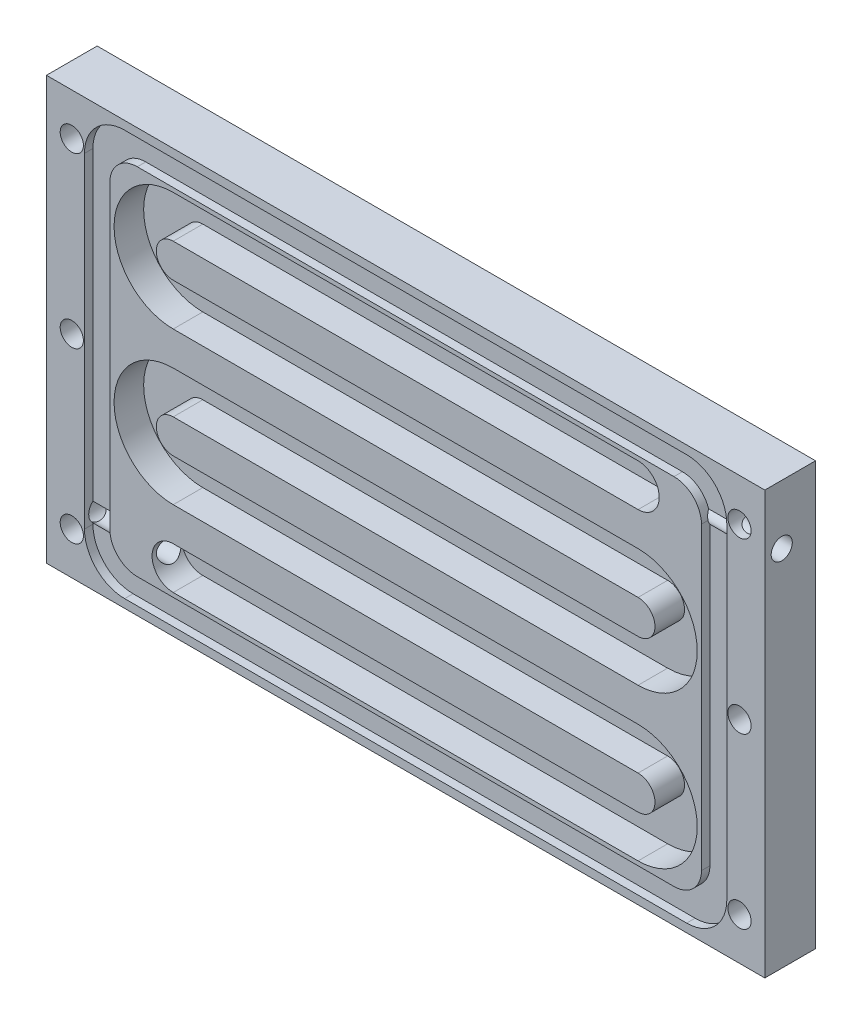
from build123d import *

# Parameters (mm, degrees)
SKETCH_1_W          = 170
SKETCH_1_H          = 100
EXTRUDE_1_DEPTH     = 12
CUT_EXTRUDE_1_DEPTH = 7
CUT_EXTRUDE_2_DEPTH = 7
CUT_EXTRUDE_3_DEPTH = 2
SKETCH_5_R          = 2.75
CUT_EXTRUDE_4_DEPTH = 100.342840708
SKETCH_6_R          = 3
CUT_EXTRUDE_5_DEPTH = 30
SKETCH_7_R          = 2.5
CUT_EXTRUDE_6_DEPTH = 30
SKETCH_8_R          = 2
CUT_EXTRUDE_7_DEPTH = 4


with BuildPart() as part:
    # 草图1 → 凸台-拉伸1 (new body)
    with BuildSketch(Plane.XY):
        Rectangle(SKETCH_1_W, SKETCH_1_H)
    extrude(amount=EXTRUDE_1_DEPTH)

    # 草图2 → 切除-拉伸1 (cut)
    with BuildSketch(Plane.XY.offset(12)):
        with BuildLine():
            Line((-55, -41), (55, -41))
            ThreePointArc((55, -41), (60, -36), (55, -31))
            Line((55, -31), (-55, -31))
            ThreePointArc((-55, -31), (-60, -36), (-55, -41))
        make_face()
        with BuildLine():
            Line((-55, -23), (55, -23))
            ThreePointArc((55, -23), (60, -18), (55, -13))
            Line((55, -13), (-55, -13))
            ThreePointArc((-55, -13), (-60, -18), (-55, -23))
        make_face()
        with BuildLine():
            Line((-55, -5), (55, -5))
            ThreePointArc((55, -5), (60, 0), (55, 5))
            Line((55, 5), (-55, 5))
            ThreePointArc((-55, 5), (-60, 0), (-55, -5))
        make_face()
        with BuildLine():
            Line((-55, 13), (55, 13))
            ThreePointArc((55, 13), (60, 18), (55, 23))
            Line((55, 23), (-55, 23))
            ThreePointArc((-55, 23), (-60, 18), (-55, 13))
        make_face()
        with BuildLine():
            Line((-55, 31), (55, 31))
            ThreePointArc((55, 31), (60, 36), (55, 41))
            Line((55, 41), (-55, 41))
            ThreePointArc((-55, 41), (-60, 36), (-55, 31))
        make_face()
    extrude(amount=-CUT_EXTRUDE_1_DEPTH, mode=Mode.SUBTRACT)

    # 草图3 → 切除-拉伸2 (cut)
    with BuildSketch(Plane.XY.offset(12)):
        with BuildLine():
            Line((55, -13), (55, -23))
            ThreePointArc((55, -23), (59, -27), (55, -31))
            Line((55, -31), (55, -41))
            ThreePointArc((55, -41), (69, -27), (55, -13))
        make_face()
        with BuildLine():
            Line((-55, -23), (-55, -13))
            ThreePointArc((-55, -13), (-59, -9), (-55, -5))
            Line((-55, -5), (-55, 5))
            ThreePointArc((-55, 5), (-69, -9), (-55, -23))
        make_face()
        with BuildLine():
            Line((55, 23), (55, 13))
            ThreePointArc((55, 13), (59, 9), (55, 5))
            Line((55, 5), (55, -5))
            ThreePointArc((55, -5), (69, 9), (55, 23))
        make_face()
        with BuildLine():
            Line((-55, 13), (-55, 23))
            ThreePointArc((-55, 23), (-59, 27), (-55, 31))
            Line((-55, 31), (-55, 41))
            ThreePointArc((-55, 41), (-69, 27), (-55, 13))
        make_face()
    extrude(amount=-CUT_EXTRUDE_2_DEPTH, mode=Mode.SUBTRACT)

    # 草图4 → 切除-拉伸3 (cut)
    with BuildSketch(Plane.XY.offset(12)):
        with BuildLine():
            Line((-66.5, -48), (66.5, -48))
            ThreePointArc((66.5, -48), (73.217514421, -45.217514421), (76, -38.5))
            Line((76, -38.5), (76, 38.5))
            ThreePointArc((76, 38.5), (73.217514421, 45.217514421), (66.5, 48))
            Line((66.5, 48), (-66.5, 48))
            ThreePointArc((-66.5, 48), (-73.217514421, 45.217514421), (-76, 38.5))
            Line((-76, 38.5), (-76, -38.5))
            ThreePointArc((-76, -38.5), (-73.217514421, -45.217514421), (-66.5, -48))
        make_face()
        with BuildLine():
            Line((-63.5, -42), (63.5, -42))
            ThreePointArc((63.5, -42), (68.096194078, -40.096194078), (70, -35.5))
            Line((70, -35.5), (70, 35.5))
            ThreePointArc((70, 35.5), (68.096194078, 40.096194078), (63.5, 42))
            Line((63.5, 42), (-63.5, 42))
            ThreePointArc((-63.5, 42), (-68.096194078, 40.096194078), (-70, 35.5))
            Line((-70, 35.5), (-70, -35.5))
            ThreePointArc((-70, -35.5), (-68.096194078, -40.096194078), (-63.5, -42))
        make_face(mode=Mode.SUBTRACT)
    extrude(amount=-CUT_EXTRUDE_3_DEPTH, mode=Mode.SUBTRACT)

    # 草图5 → 切除-拉伸4 (cut, through all)
    with BuildSketch(Plane.XY):
        with Locations((-79, -40)):
            Circle(SKETCH_5_R)
        with Locations((-79, 0)):
            Circle(SKETCH_5_R)
        with Locations((-79, 40)):
            Circle(SKETCH_5_R)
        with Locations((79, -40)):
            Circle(SKETCH_5_R)
        with Locations((79, 0)):
            Circle(SKETCH_5_R)
        with Locations((79, 40)):
            Circle(SKETCH_5_R)
    extrude(amount=CUT_EXTRUDE_4_DEPTH, mode=Mode.SUBTRACT)

    # 草图6 → 切除-拉伸5 (cut)
    with BuildSketch(Plane(origin=(-85, 0, 0), x_dir=(0, 0, -1), z_dir=(1, 0, 0))):
        with Locations((-8, -36)):
            Circle(SKETCH_6_R)
    extrude(amount=CUT_EXTRUDE_5_DEPTH, mode=Mode.SUBTRACT)

    # 草图7 → 切除-拉伸6 (cut)
    with BuildSketch(Plane(origin=(85, 0, 0), x_dir=(0, 0, -1), z_dir=(1, 0, 0))):
        with Locations((-8, 36)):
            Circle(SKETCH_7_R)
    extrude(amount=-CUT_EXTRUDE_6_DEPTH, mode=Mode.SUBTRACT)

    # 草图8 → 切除-拉伸7 (cut)
    with BuildSketch(Plane.XY):
        Circle(SKETCH_8_R)
    extrude(amount=CUT_EXTRUDE_7_DEPTH, mode=Mode.SUBTRACT)


solid = part.part
